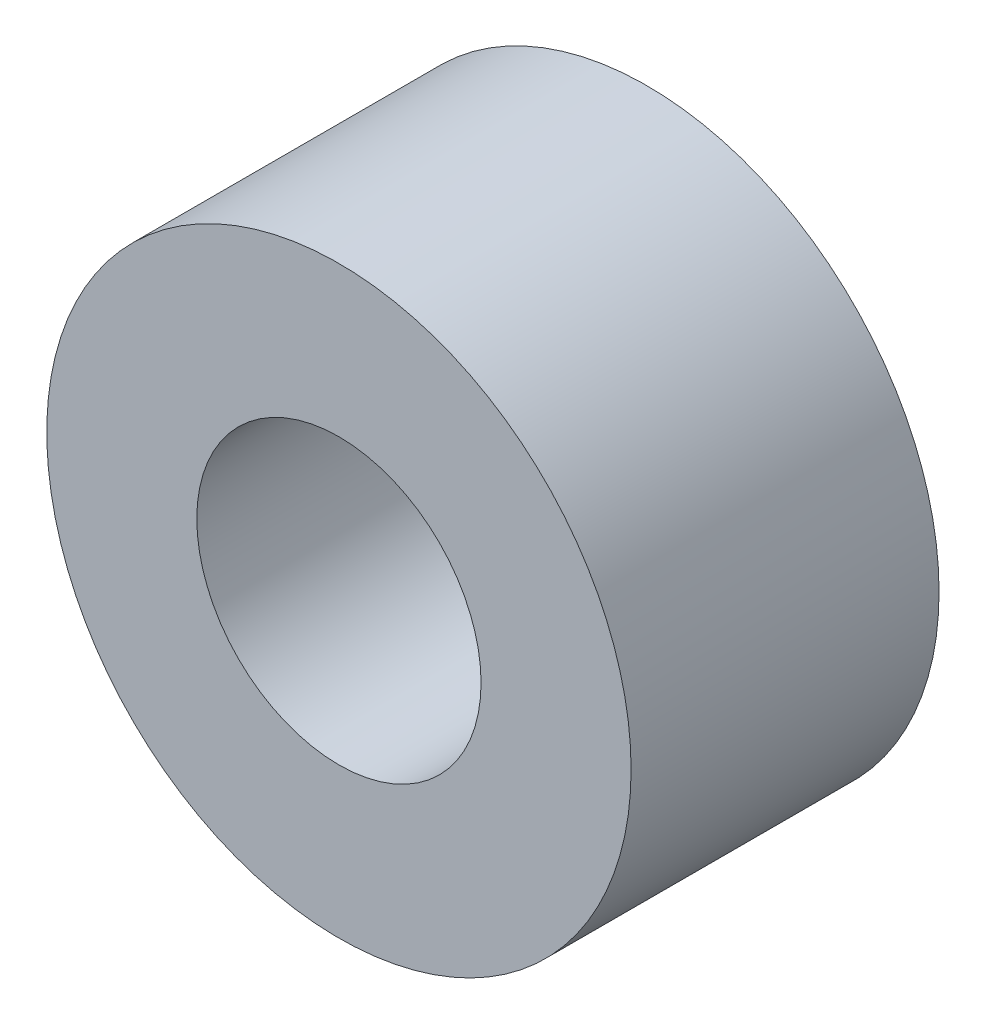
from build123d import *

# Parameters (mm, degrees)
SKETCH_1_R          = 18.5
EXTRUDE_1_DEPTH     = 19.5
SKETCH_2_R          = 9
CUT_EXTRUDE_2_DEPTH = 30


with BuildPart() as part:
    # 草图1 → 拉伸1 (new body)
    with BuildSketch(Plane.XY):
        Circle(SKETCH_1_R)
    extrude(amount=EXTRUDE_1_DEPTH)

    # 草图2 → 切除-拉伸2 (cut)
    with BuildSketch(Plane.XY.offset(19.5)):
        Circle(SKETCH_2_R)
    extrude(amount=-CUT_EXTRUDE_2_DEPTH, mode=Mode.SUBTRACT)


solid = part.part
